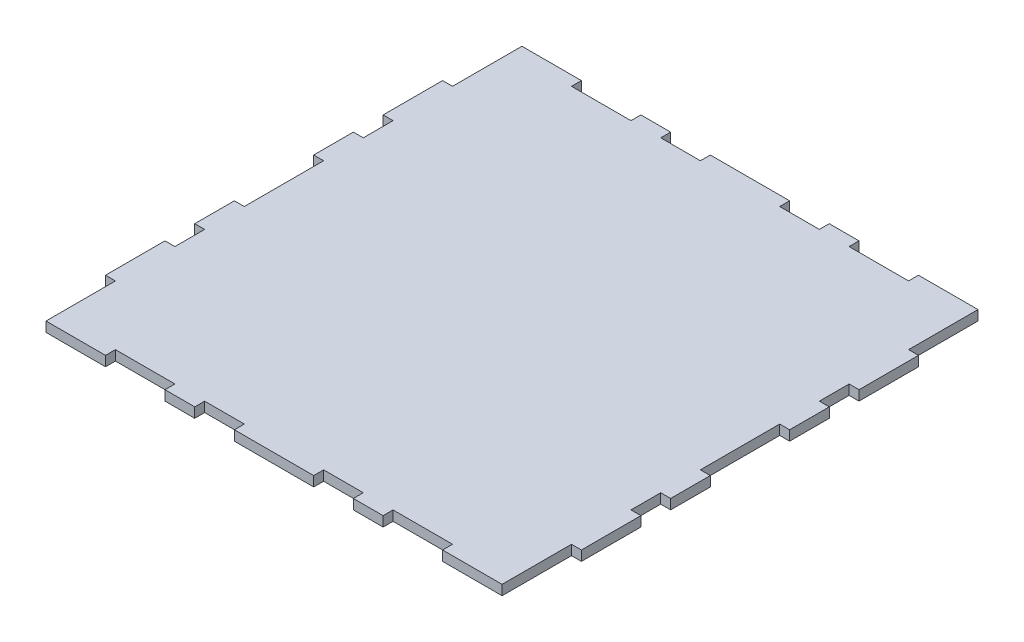
from build123d import *

# Parameters (mm, degrees)
BOSS_EXTRUDE1_DEPTH = 6.35


with BuildPart() as part:
    # Sketch1 → Boss-Extrude1 (new body)
    with BuildSketch(Plane(origin=(0, 0, 0), x_dir=(1, 0, 0), z_dir=(0, 1, 0))):
        Polygon((152.4, 152.4), (6.35, 152.4), (6.35, 127), (0, 127), (0, 101.6), (6.35, 101.6), (6.35, 82.55), (0, 82.55), (0, 44.45), (6.35, 44.45), (6.35, 0), (44.45, 0), (44.45, 6.35), (82.55, 6.35), (82.55, 0), (101.6, 0), (101.6, 6.35), (127, 6.35), (127, 0), (152.4, 0), align=None)
        Polygon((6.35, 177.8), (6.35, 152.4), (152.4, 152.4), (152.4, 304.8), (127, 304.8), (127, 298.45), (101.6, 298.45), (101.6, 304.8), (82.55, 304.8), (82.55, 298.45), (44.45, 298.45), (44.45, 304.8), (6.35, 304.8), (6.35, 260.35), (0, 260.35), (0, 222.25), (6.35, 222.25), (6.35, 203.2), (0, 203.2), (0, 177.8), align=None)
        Polygon((152.4, 304.8), (152.4, 152.4), (298.45, 152.4), (298.45, 177.8), (304.8, 177.8), (304.8, 203.2), (298.45, 203.2), (298.45, 222.25), (304.8, 222.25), (304.8, 260.35), (298.45, 260.35), (298.45, 304.8), (260.35, 304.8), (260.35, 298.45), (222.25, 298.45), (222.25, 304.8), (203.2, 304.8), (203.2, 298.45), (177.8, 298.45), (177.8, 304.8), align=None)
        Polygon((298.45, 152.4), (152.4, 152.4), (152.4, 0), (177.8, 0), (177.8, 6.35), (203.2, 6.35), (203.2, 0), (222.25, 0), (222.25, 6.35), (260.35, 6.35), (260.35, 0), (298.45, 0), (298.45, 44.45), (304.8, 44.45), (304.8, 82.55), (298.45, 82.55), (298.45, 101.6), (304.8, 101.6), (304.8, 127), (298.45, 127), align=None)
    extrude(amount=BOSS_EXTRUDE1_DEPTH)


solid = part.part
